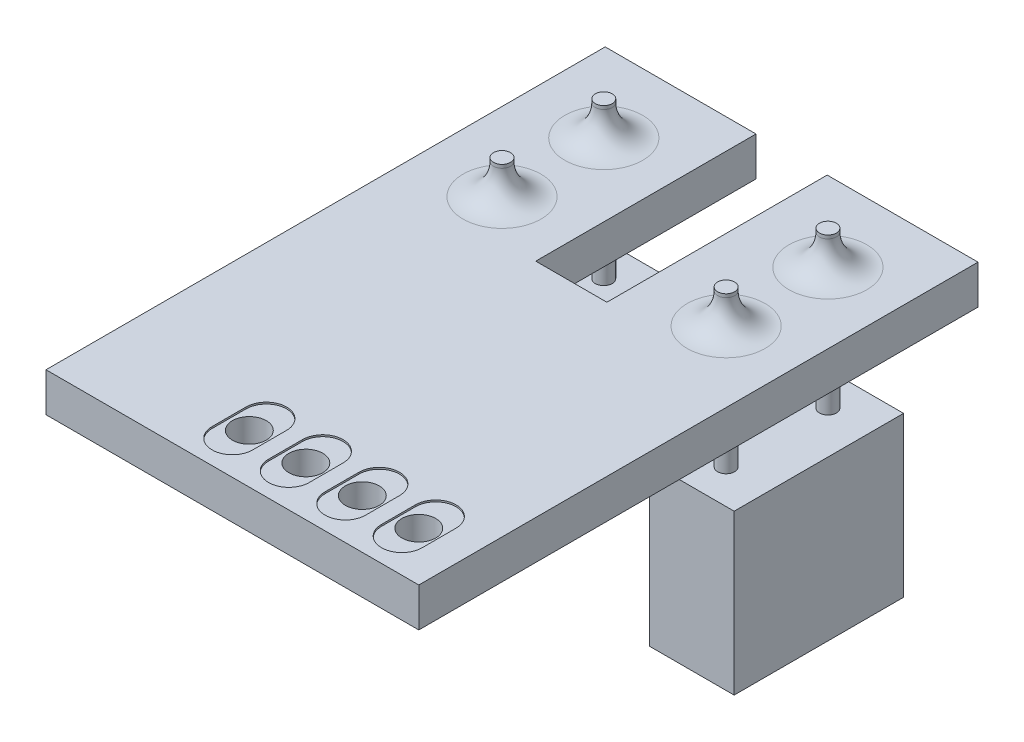
from build123d import *

# Parameters (mm, degrees)
SKETCH1_R                = 0.5
BOSS_EXTRUDE1_DEPTH      = 1.15
BOSS_EXTRUDE2_DEPTH      = 1
BOSS_EXTRUDE2_DEPTH_BACK = 3.6
SKETCH2_R                = 0.25
SKETCH3_W                = 2.5
SKETCH3_H                = 5
BOSS_EXTRUDE3_DEPTH      = 4.7
CUT_EXTRUDE1_DEPTH       = 0.05
FILLET1_R                = 0.9


with BuildPart() as part:
    # Sketch1 → Boss-Extrude1 (new body)
    with BuildSketch(Plane(origin=(0, 0, 0), x_dir=(1, 0, 0), z_dir=(0, 1, 0))):
        Polygon((0, 0), (0, 16.5), (4.45, 16.5), (4.45, 10), (6.55, 10), (6.55, 16.5), (11, 16.5), (11, 0), align=None)
        with Locations(Location((9.5, 1.5, 0), (0, 0, 270))):
            Circle(SKETCH1_R, mode=Mode.SUBTRACT)
        with Locations(Location((7.833333333, 1.5, 0), (0, 0, 270))):
            Circle(SKETCH1_R, mode=Mode.SUBTRACT)
        with Locations(Location((6.166666667, 1.5, 0), (0, 0, 270))):
            Circle(SKETCH1_R, mode=Mode.SUBTRACT)
        with Locations(Location((4.5, 1.5, 0), (0, 0, 270))):
            Circle(SKETCH1_R, mode=Mode.SUBTRACT)
    extrude(amount=BOSS_EXTRUDE1_DEPTH)

    # Sketch2 → Boss-Extrude2 (add, two sides: drawn at the far end of the back side and taken through both)
    with BuildSketch(Plane(origin=(0, 1.15, 0), x_dir=(1, 0, 0), z_dir=(0, 1, 0)).offset(-BOSS_EXTRUDE2_DEPTH_BACK)):
        with Locations(Location((2.303324378, 14.15500421, 0), (0, 0, 270))):
            Circle(SKETCH2_R)
        with Locations(Location((2.303324378, 11.151722015, 0), (0, 0, 270))):
            Circle(SKETCH2_R)
        with Locations(Location((8.916612443, 11.151722015, 0), (0, 0, 270))):
            Circle(SKETCH2_R)
        with Locations(Location((8.916612443, 14.15500421, 0), (0, 0, 270))):
            Circle(SKETCH2_R)
    extrude(amount=BOSS_EXTRUDE2_DEPTH + BOSS_EXTRUDE2_DEPTH_BACK)

    # Sketch3 → Boss-Extrude3 (add)
    with BuildSketch(Plane.XZ.offset(2.45)):
        with Locations((2.303324378, -12.637884748)):
            Rectangle(SKETCH3_W, SKETCH3_H)
        with Locations((8.916612443, -12.637884748)):
            Rectangle(SKETCH3_W, SKETCH3_H)
    extrude(amount=BOSS_EXTRUDE3_DEPTH)

    # Sketch4 → Cut-Extrude1 (cut)
    with BuildSketch(Plane(origin=(0, 1.15, 0), x_dir=(1, 0, 0), z_dir=(0, 1, 0))):
        with BuildLine():
            Line((3.901788048, 1), (3.901788048, 2))
            ThreePointArc((3.901788048, 2), (4.5, 2.598211952), (5.098211952, 2))
            Line((5.098211952, 2), (5.098211952, 1))
            ThreePointArc((5.098211952, 1), (4.5, 0.401788048), (3.901788048, 1))
        make_face()
        with BuildLine():
            Line((5.568454715, 1), (5.568454715, 2))
            ThreePointArc((5.568454715, 2), (6.166666667, 2.598211952), (6.764878619, 2))
            Line((6.764878619, 2), (6.764878619, 1))
            ThreePointArc((6.764878619, 1), (6.166666667, 0.401788048), (5.568454715, 1))
        make_face()
        with BuildLine():
            Line((7.235121381, 1), (7.235121381, 2))
            ThreePointArc((7.235121381, 2), (7.833333333, 2.598211952), (8.431545285, 2))
            Line((8.431545285, 2), (8.431545285, 1))
            ThreePointArc((8.431545285, 1), (7.833333333, 0.401788048), (7.235121381, 1))
        make_face()
        with BuildLine():
            Line((8.901788048, 1), (8.901788048, 2))
            ThreePointArc((8.901788048, 2), (9.5, 2.598211952), (10.098211952, 2))
            Line((10.098211952, 2), (10.098211952, 1))
            ThreePointArc((10.098211952, 1), (9.5, 0.401788048), (8.901788048, 1))
        make_face()
    extrude(amount=-CUT_EXTRUDE1_DEPTH, mode=Mode.SUBTRACT)

    # Fillet1
    fillet1_edges = [part.edges().sort_by_distance(p)[0] for p in [
        (2.303324378, 1.15, -14.40500421),
        (2.303324378, 1.15, -11.401722015),
        (8.916612443, 1.15, -11.401722015),
        (8.916612443, 1.15, -14.40500421),
    ]]
    fillet(fillet1_edges, radius=FILLET1_R)


solid = part.part
